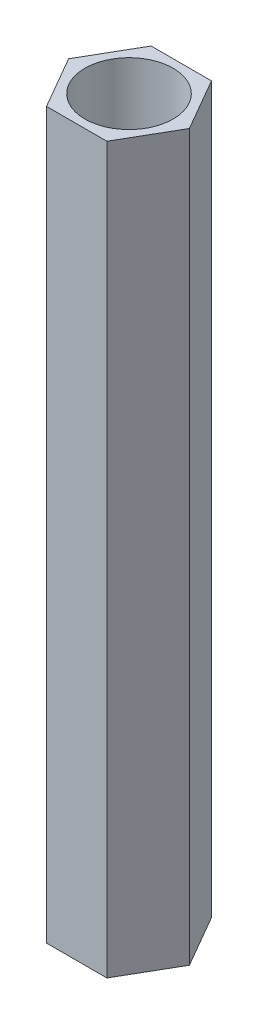
from build123d import *

# Parameters (mm, degrees)
CROQUIS1_R              = 1.825
SALIENTE_EXTRUIR1_DEPTH = 30


with BuildPart() as part:
    # Croquis1 → Saliente-Extruir1 (new body)
    with BuildSketch(Plane(origin=(0, 0, 0), x_dir=(1, 0, 0), z_dir=(0, 1, 0))):
        Polygon((2.5, 0), (1.25, 2.165063509), (-1.25, 2.165063509), (-2.5, 0), (-1.25, -2.165063509), (1.25, -2.165063509), align=None)
        with Locations(Location((0, 0, 0), (0, 0, 270))):
            Circle(CROQUIS1_R, mode=Mode.SUBTRACT)
    extrude(amount=SALIENTE_EXTRUIR1_DEPTH)


solid = part.part
